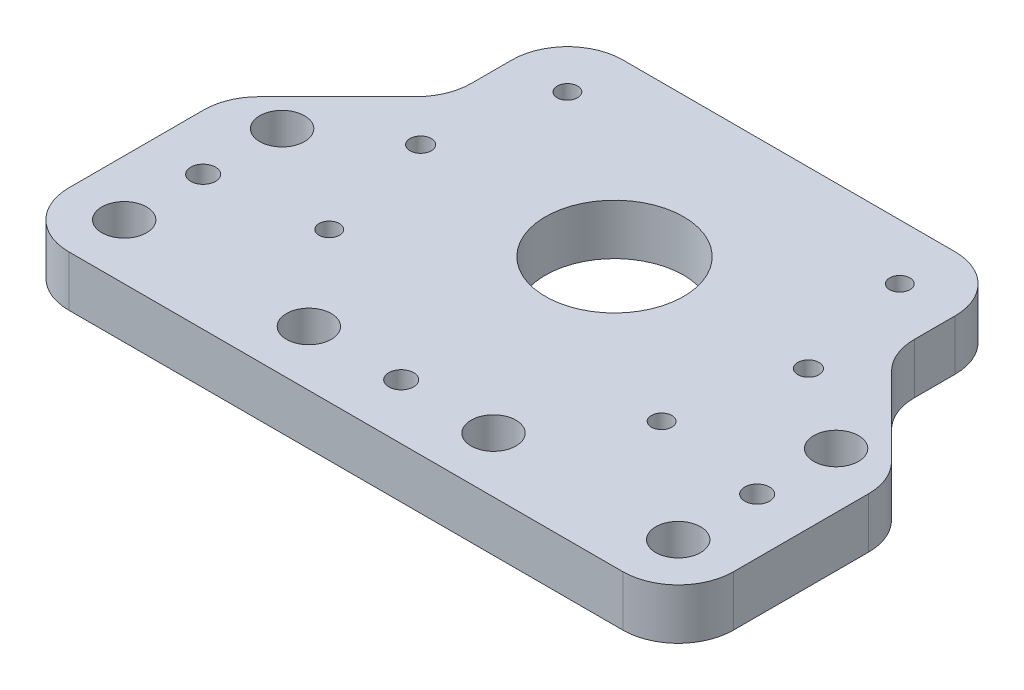
from build123d import *

# Parameters (mm, degrees)
SKETCH1_R           = 8
BOSS_EXTRUDE1_DEPTH = 5.8
SKETCH2_R           = 1.3
CUT_EXTRUDE1_DEPTH  = 92.764481146
SKETCH14_R          = 1.25
M3_TAP_DEPTH        = 92.764481146
SKETCH15_R          = 2.65
M5_THROUGH_DEPTH    = 92.764481146
CUT_EXTRUDE2_DEPTH  = 92.764481146
FILLET2_R           = 6.35
SKETCH13_R          = 1.5
CUT_EXTRUDE3_DEPTH  = 92.764481146
MOVE_FACE1_BY       = 0.08
MOVE_FACE1_2_BY     = 0.08
MOVE_FACE1_3_BY     = 0.08
MOVE_FACE1_4_BY     = 0.08
MOVE_FACE1_5_BY     = 0.08
MOVE_FACE1_6_BY     = 0.08
MOVE_FACE1_7_BY     = 0.08
MOVE_FACE1_8_BY     = 0.08
MOVE_FACE1_9_BY     = 0.08
MOVE_FACE1_10_BY    = 0.08
MOVE_FACE1_11_BY    = 0.08
MOVE_FACE1_12_BY    = 0.08
MOVE_FACE1_13_BY    = 0.08
MOVE_FACE1_14_BY    = 0.08
MOVE_FACE1_15_BY    = 0.08
MOVE_FACE1_16_BY    = 0.08


with BuildPart() as part:
    # Sketch1 → Boss-Extrude1 (new body)
    with BuildSketch(Plane(origin=(0, 0, 0), x_dir=(1, 0, 0), z_dir=(0, 1, 0))):
        Polygon((0, 0), (76.2, 0), (76.2, 50.8), (38.1, 50.8), (0, 50.8), align=None)
        with Locations(Location((38.1, 30.8, 0), (0, 0, 270))):
            Circle(SKETCH1_R, mode=Mode.SUBTRACT)
    extrude(amount=BOSS_EXTRUDE1_DEPTH)

    # Sketch2 → Cut-Extrude1 (cut, through all)
    with BuildSketch(Plane(origin=(0, 5.8, 0), x_dir=(1, 0, 0), z_dir=(0, 1, 0))):
        with Locations(Location((15.875, 30.8, 0), (0, 0, 270))):
            Circle(SKETCH2_R)
        with Locations(Location((60.325, 30.8, 0), (0, 0, 270))):
            Circle(SKETCH2_R)
    extrude(amount=-CUT_EXTRUDE1_DEPTH, mode=Mode.SUBTRACT)

    # Sketch14 → M3-tap (cut, through all)
    with BuildSketch(Plane.XZ):
        with Locations(Location((57.15, -44.45, 0), (0, 0, 270))):
            Circle(SKETCH14_R)
        with Locations(Location((19.05, -44.45, 0), (0, 0, 270))):
            Circle(SKETCH14_R)
        with Locations(Location((19.05, -17.15, 0), (0, 0, 270))):
            Circle(SKETCH14_R)
        with Locations(Location((57.15, -17.15, 0), (0, 0, 270))):
            Circle(SKETCH14_R)
    extrude(amount=-M3_TAP_DEPTH, mode=Mode.SUBTRACT)

    # Sketch15 → M5-through (cut, through all)
    with BuildSketch(Plane.XZ):
        with Locations(Location((69.85, -24.45004, 0), (0, 0, 270))):
            Circle(SKETCH15_R)
        with Locations(Location((69.85, -6.35, 0), (0, 0, 270))):
            Circle(SKETCH15_R)
        with Locations(Location((48.683333333, -6.35, 0), (0, 0, 270))):
            Circle(SKETCH15_R)
        with Locations(Location((27.516666667, -6.35, 0), (0, 0, 270))):
            Circle(SKETCH15_R)
        with Locations(Location((6.35, -6.35, 0), (0, 0, 270))):
            Circle(SKETCH15_R)
        with Locations(Location((6.35, -24.45004, 0), (0, 0, 270))):
            Circle(SKETCH15_R)
    extrude(amount=-M5_THROUGH_DEPTH, mode=Mode.SUBTRACT)

    # Sketch12 → Cut-Extrude2 (cut, through all)
    with BuildSketch(Plane(origin=(0, 5.8, 0), x_dir=(1, 0, 0), z_dir=(0, 1, 0))):
        Polygon((0, 50.8), (12.7, 50.8), (12.7, 37.15), (0, 24.45), align=None)
        Polygon((63.5, 50.8), (63.5, 37.15), (76.2, 24.45), (76.2, 50.8), align=None)
    extrude(amount=-CUT_EXTRUDE2_DEPTH, mode=Mode.SUBTRACT)

    # Fillet2
    fillet2_edges = [part.edges().sort_by_distance(p)[0] for p in [
        (0, 2.9, -24.45),
        (12.7, 2.9, -50.8),
        (12.7, 2.9, -37.15),
        (76.2, 2.9, 0),
        (63.5, 2.9, -50.8),
        (0, 2.9, 0),
        (76.2, 2.9, -24.45),
        (63.5, 2.9, -37.15),
    ]]
    fillet(fillet2_edges, radius=FILLET2_R)

    # Sketch13 → Cut-Extrude3 (cut, through all)
    with BuildSketch(Plane.XZ):
        with Locations(Location((69.85, -15.40002, 0), (0, 0, 270))):
            Circle(SKETCH13_R)
        with Locations(Location((38.1, -6.35, 0), (0, 0, 270))):
            Circle(SKETCH13_R)
        with Locations(Location((6.35, -15.40002, 0), (0, 0, 270))):
            Circle(SKETCH13_R)
    extrude(amount=-CUT_EXTRUDE3_DEPTH, mode=Mode.SUBTRACT)

    # Move Face1: a curved face moved outward by 0.08
    add(Solid.thicken(part.faces().sort_by_distance((38.1, 2.9, -38.8))[0], MOVE_FACE1_BY))

    # Move Face1 2: a curved face moved outward by 0.08
    add(Solid.thicken(part.faces().sort_by_distance((15.875, 2.9, -32.1))[0], MOVE_FACE1_2_BY))

    # Move Face1 3: a curved face moved outward by 0.08
    add(Solid.thicken(part.faces().sort_by_distance((60.325, 2.9, -32.1))[0], MOVE_FACE1_3_BY))

    # Move Face1 4: a curved face moved outward by 0.08
    add(Solid.thicken(part.faces().sort_by_distance((57.15, 2.9, -43.2))[0], MOVE_FACE1_4_BY))

    # Move Face1 5: a curved face moved outward by 0.08
    add(Solid.thicken(part.faces().sort_by_distance((19.05, 2.9, -43.2))[0], MOVE_FACE1_5_BY))

    # Move Face1 6: a curved face moved outward by 0.08
    add(Solid.thicken(part.faces().sort_by_distance((19.05, 2.9, -15.9))[0], MOVE_FACE1_6_BY))

    # Move Face1 7: a curved face moved outward by 0.08
    add(Solid.thicken(part.faces().sort_by_distance((57.15, 2.9, -15.9))[0], MOVE_FACE1_7_BY))

    # Move Face1 8: a curved face moved outward by 0.08
    add(Solid.thicken(part.faces().sort_by_distance((69.85, 2.9, -21.80004))[0], MOVE_FACE1_8_BY))

    # Move Face1 9: a curved face moved outward by 0.08
    add(Solid.thicken(part.faces().sort_by_distance((69.85, 2.9, -3.7))[0], MOVE_FACE1_9_BY))

    # Move Face1 10: a curved face moved outward by 0.08
    add(Solid.thicken(part.faces().sort_by_distance((48.683333333, 2.9, -3.7))[0], MOVE_FACE1_10_BY))

    # Move Face1 11: a curved face moved outward by 0.08
    add(Solid.thicken(part.faces().sort_by_distance((27.516666667, 2.9, -3.7))[0], MOVE_FACE1_11_BY))

    # Move Face1 12: a curved face moved outward by 0.08
    add(Solid.thicken(part.faces().sort_by_distance((6.35, 2.9, -3.7))[0], MOVE_FACE1_12_BY))

    # Move Face1 13: a curved face moved outward by 0.08
    add(Solid.thicken(part.faces().sort_by_distance((6.35, 2.9, -21.80004))[0], MOVE_FACE1_13_BY))

    # Move Face1 14: a curved face moved outward by 0.08
    add(Solid.thicken(part.faces().sort_by_distance((69.85, 2.9, -13.90002))[0], MOVE_FACE1_14_BY))

    # Move Face1 15: a curved face moved outward by 0.08
    add(Solid.thicken(part.faces().sort_by_distance((38.1, 2.9, -4.85))[0], MOVE_FACE1_15_BY))

    # Move Face1 16: a curved face moved outward by 0.08
    add(Solid.thicken(part.faces().sort_by_distance((6.35, 2.9, -13.90002))[0], MOVE_FACE1_16_BY))


solid = part.part
